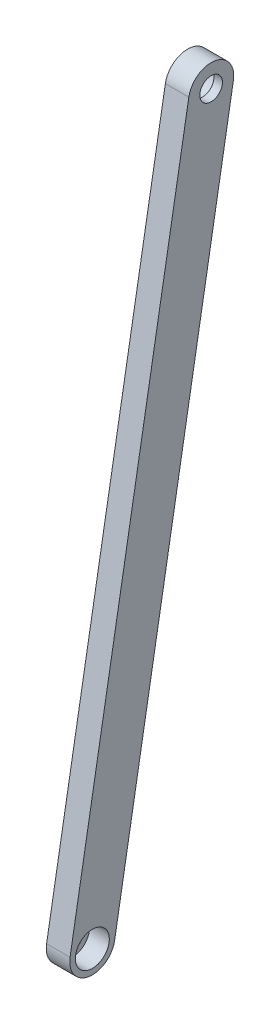
from build123d import *

# Parameters (mm, degrees)
BOSS_EXTRUDE1_START = -11.35
SKETCH2_R           = 2
BOSS_EXTRUDE1_DEPTH = 4.15
CUT_EXTRUDE1_START  = -15.5
SKETCH2_3_R         = 3
SKETCH2_3_R_2       = 2
CUT_EXTRUDE1_DEPTH  = 2.65
CUT_EXTRUDE2_START  = -12.85
SKETCH2_4_R         = 2
CUT_EXTRUDE2_DEPTH  = 1.5
CUT_EXTRUDE3_START  = -14.85
SKETCH2_5_R         = 3
CUT_EXTRUDE3_DEPTH  = 3.5


with BuildPart() as part:
    # Sketch2 → Boss-Extrude1 (new body)
    with BuildSketch(Plane(origin=(0, 0, 0), x_dir=(0, 0, -1), z_dir=(1, 0, 0)).offset(BOSS_EXTRUDE1_START)):
        with BuildLine():
            Line((24.941275851, 120.517105669), (3.941275851, -0.682894331))
            ThreePointArc((3.941275851, -0.682894331), (-0.682894331, -3.941275851), (-3.941275851, 0.682894331))
            Line((-3.941275851, 0.682894331), (17.058724149, 121.882894331))
            ThreePointArc((17.058724149, 121.882894331), (21.682894331, 125.141275851), (24.941275851, 120.517105669))
        make_face()
        Circle(SKETCH2_R, mode=Mode.SUBTRACT)
    extrude(amount=-BOSS_EXTRUDE1_DEPTH)

    # Sketch2<3> → Cut-Extrude1 (cut)
    # profile 1 of 2: a face of its own
    with BuildSketch(Plane(origin=(0, 0, 0), x_dir=(0, 0, -1), z_dir=(1, 0, 0)).offset(CUT_EXTRUDE1_START)):
        with Locations((21, 121.2)):
            Circle(SKETCH2_3_R)
        with Locations((21, 121.2)):
            Circle(SKETCH2_3_R_2, mode=Mode.SUBTRACT)
    # profile 2 of 2: a face of its own
    with BuildSketch(Plane(origin=(0, 0, 0), x_dir=(0, 0, -1), z_dir=(1, 0, 0)).offset(CUT_EXTRUDE1_START)):
        with Locations((21, 121.2)):
            Circle(SKETCH2_3_R_2)
    extrude(amount=CUT_EXTRUDE1_DEPTH, mode=Mode.SUBTRACT)

    # Sketch2<4> → Cut-Extrude2 (cut)
    with BuildSketch(Plane(origin=(0, 0, 0), x_dir=(0, 0, -1), z_dir=(1, 0, 0)).offset(CUT_EXTRUDE2_START)):
        with Locations((21, 121.2)):
            Circle(SKETCH2_4_R)
    extrude(amount=CUT_EXTRUDE2_DEPTH, mode=Mode.SUBTRACT)

    # Sketch2<5> → Cut-Extrude3 (cut)
    with BuildSketch(Plane(origin=(0, 0, 0), x_dir=(0, 0, -1), z_dir=(1, 0, 0)).offset(CUT_EXTRUDE3_START)):
        Circle(SKETCH2_5_R)
    extrude(amount=CUT_EXTRUDE3_DEPTH, mode=Mode.SUBTRACT)


solid = part.part
